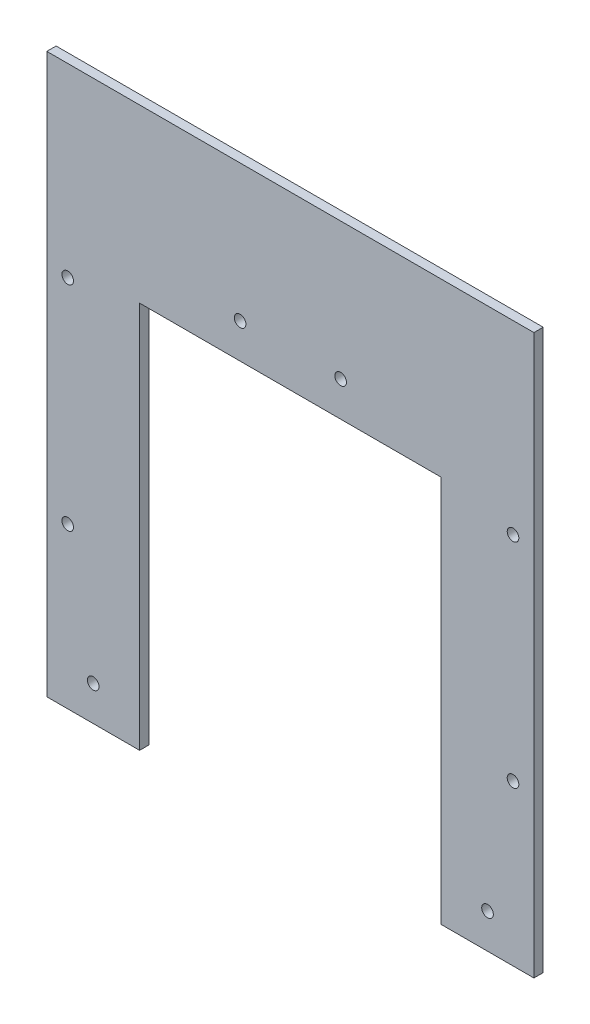
from build123d import *

# Parameters (mm, degrees)
CROQUIS1_R              = 2.5
SALIENTE_EXTRUIR1_DEPTH = 4


with BuildPart() as part:
    # Croquis1 → Saliente-Extruir1 (new body)
    with BuildSketch(Plane.XY):
        Polygon((70, 0), (70, 167), (-60, 167), (-60, 0), (-100, 0), (-100, 241), (110, 241), (110, 0), align=None)
        with Locations((-80, 15)):
            Circle(CROQUIS1_R, mode=Mode.SUBTRACT)
        with Locations((-91, 69.01)):
            Circle(CROQUIS1_R, mode=Mode.SUBTRACT)
        with Locations((-91, 161.01)):
            Circle(CROQUIS1_R, mode=Mode.SUBTRACT)
        with Locations((-16.666666667, 182)):
            Circle(CROQUIS1_R, mode=Mode.SUBTRACT)
        with Locations((26.666666667, 182)):
            Circle(CROQUIS1_R, mode=Mode.SUBTRACT)
        with Locations((101, 161.01)):
            Circle(CROQUIS1_R, mode=Mode.SUBTRACT)
        with Locations((101, 69.01)):
            Circle(CROQUIS1_R, mode=Mode.SUBTRACT)
        with Locations((90, 15)):
            Circle(CROQUIS1_R, mode=Mode.SUBTRACT)
    extrude(amount=SALIENTE_EXTRUIR1_DEPTH)


solid = part.part
